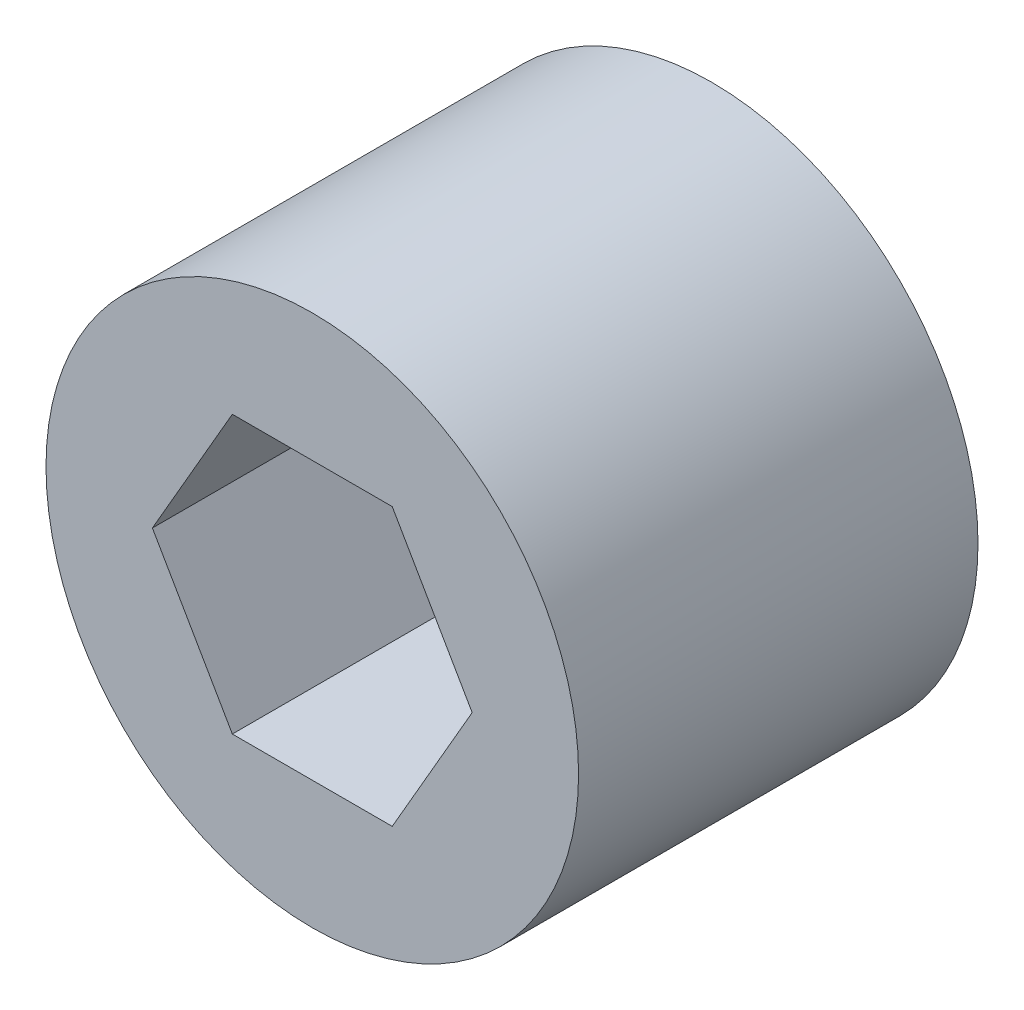
from build123d import *

# Parameters (mm, degrees)
SKETCH1_R           = 12.7
BOSS_EXTRUDE1_DEPTH = 19.05


with BuildPart() as part:
    # Sketch1 → Boss-Extrude1 (new body)
    with BuildSketch(Plane.XY):
        with Locations(Location((0, 0, 0), (0, 0, 180))):
            Circle(SKETCH1_R)
        Polygon((3.812821178, -6.604), (7.625642355, 0), (3.812821178, 6.604), (-3.812821178, 6.604), (-7.625642355, 0), (-3.812821178, -6.604), align=None, mode=Mode.SUBTRACT)
    extrude(amount=BOSS_EXTRUDE1_DEPTH)


solid = part.part
